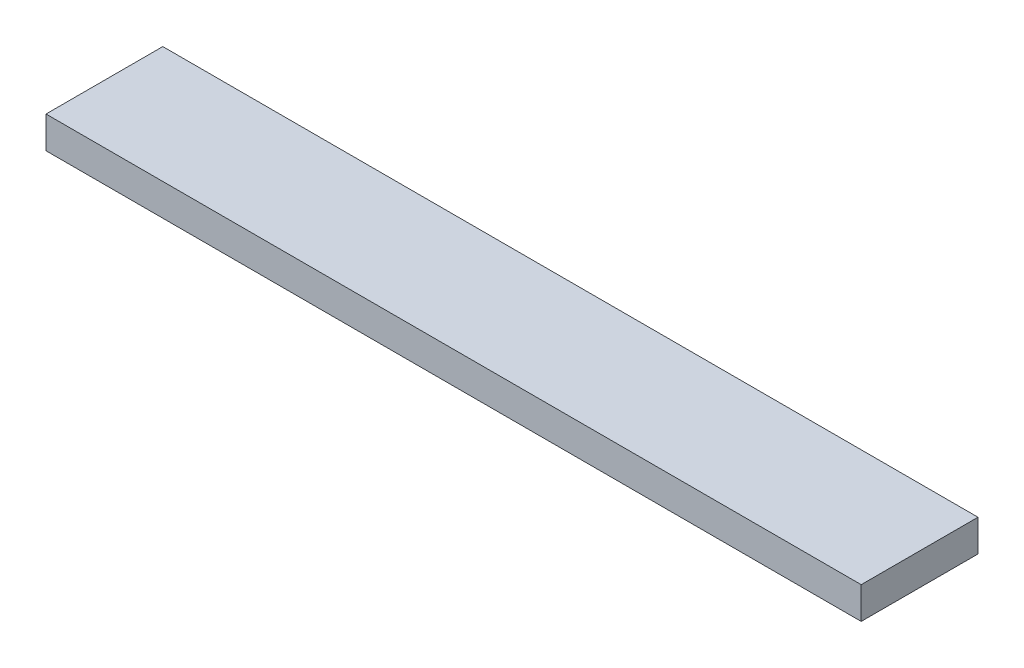
from build123d import *

# Parameters (mm, degrees)
SKETCH1_W           = 975
SKETCH1_H           = 139.7
BOSS_EXTRUDE1_DEPTH = 38.1


with BuildPart() as part:
    # Sketch1 → Boss-Extrude1 (new body)
    with BuildSketch(Plane(origin=(0, 0, 0), x_dir=(1, 0, 0), z_dir=(0, 1, 0))):
        with Locations((487.5, 69.85)):
            Rectangle(SKETCH1_W, SKETCH1_H)
    extrude(amount=BOSS_EXTRUDE1_DEPTH)


solid = part.part
